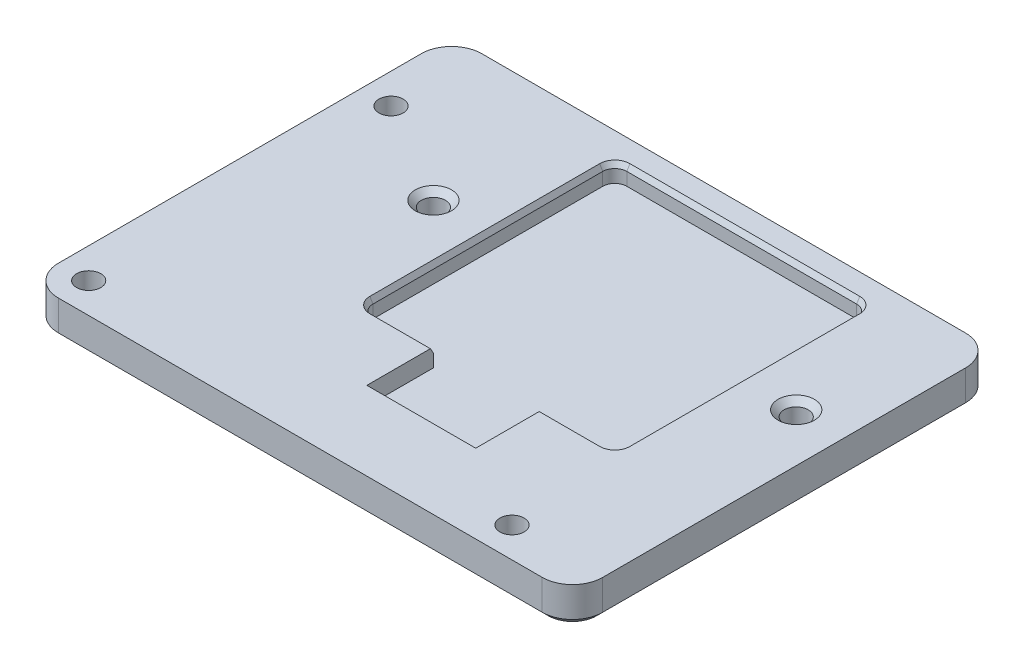
from build123d import *

# Parameters (mm, degrees)
SKETCH_1_W          = 90
SKETCH_1_H          = 70
SKETCH_1_R          = 2
EXTRUDE_1_DEPTH     = 6
FILLET_1_R          = 5
SKETCH_2_W          = 42
SKETCH_2_H          = 42
CUT_EXTRUDE_1_DEPTH = 3
SKETCH_3_W          = 18
SKETCH_3_H          = 18
CUT_EXTRUDE_2_DEPTH = 3
FILLET_2_R          = 2
CHAMFER_1_SIZE      = 2
SKETCH_4_R          = 2
CUT_EXTRUDE_3_DEPTH = 5
CHAMFER_2_SIZE      = 1
CHAMFER_3_SIZE      = 1
CHAMFER_4_SIZE      = 0.5
CHAMFER_4_SIZE2     = 0.866025404


with BuildPart() as part:
    # Эскиз1 → Бобышка-Вытянуть1 (new body)
    # profile 1 of 2: a face of its own
    with BuildSketch(Plane(origin=(0, 0, 0), x_dir=(1, 0, 0), z_dir=(0, 1, 0))):
        with Locations((5, 5)):
            Rectangle(SKETCH_1_W, SKETCH_1_H)
        with Locations(Location((35, -25, 0), (0, 0, 270))):
            Circle(SKETCH_1_R, mode=Mode.SUBTRACT)
        with Locations(Location((-35, -25, 0), (0, 0, 270))):
            Circle(SKETCH_1_R, mode=Mode.SUBTRACT)
        with Locations((35, 25)):
            Circle(SKETCH_1_R, mode=Mode.SUBTRACT)
        with Locations(Location((-35, 25, 0), (0, 0, 270))):
            Circle(SKETCH_1_R, mode=Mode.SUBTRACT)
    # profile 2 of 2: a face of its own
    with BuildSketch(Plane(origin=(0, 0, 0), x_dir=(1, 0, 0), z_dir=(0, 1, 0))):
        with Locations((35, 25)):
            Circle(SKETCH_1_R)
    extrude(amount=EXTRUDE_1_DEPTH)

    # Скругление1
    fillet_1_edges = [part.edges().sort_by_distance(p)[0] for p in [
        (-40, 3, 30),
        (-40, 3, -40),
        (50, 3, -40),
        (50, 3, 30),
    ]]
    fillet(fillet_1_edges, radius=FILLET_1_R)

    # Эскиз2 → Вырез-Вытянуть1 (cut)
    with BuildSketch(Plane(origin=(0, 6, 0), x_dir=(1, 0, 0), z_dir=(0, 1, 0))):
        with Locations((12, 15)):
            Rectangle(SKETCH_2_W, SKETCH_2_H)
    extrude(amount=-CUT_EXTRUDE_1_DEPTH, mode=Mode.SUBTRACT)

    # Эскиз3 → Вырез-Вытянуть2 (cut)
    with BuildSketch(Plane(origin=(0, 6, 0), x_dir=(1, 0, 0), z_dir=(0, 1, 0))):
        with Locations((12, -6)):
            Rectangle(SKETCH_3_W, SKETCH_3_H)
    extrude(amount=-CUT_EXTRUDE_2_DEPTH, mode=Mode.SUBTRACT)

    # Скругление2
    fillet_2_edges = [part.edges().sort_by_distance(p)[0] for p in [
        (33, 4.5, -36),
        (33, 4.5, 6),
        (-9, 4.5, 6),
        (-9, 4.5, -36),
    ]]
    fillet(fillet_2_edges, radius=FILLET_2_R)

    # Фаска1
    chamfer_1_edges = [part.edges().sort_by_distance(p)[0] for p in [
        (12, 6, 15),
    ]]
    chamfer(chamfer_1_edges, length=CHAMFER_1_SIZE)

    # Эскиз4 → Вырез-Вытянуть3 (cut)
    with BuildSketch(Plane(origin=(0, 6, 0), x_dir=(1, 0, 0), z_dir=(0, 1, 0))):
        with Locations(Location((-18, 15, 0), (0, 0, 270))):
            Circle(SKETCH_4_R)
        with Locations(Location((42, 15, 0), (0, 0, 90))):
            Circle(SKETCH_4_R)
    extrude(amount=-CUT_EXTRUDE_3_DEPTH, mode=Mode.SUBTRACT)

    # Фаска2
    chamfer_2_edges = [part.edges().sort_by_distance(p)[0] for p in [
        (-18, 6, -17),
        (42, 6, -13),
    ]]
    chamfer(chamfer_2_edges, length=CHAMFER_2_SIZE)

    # Фаска3
    chamfer_3_edges = [part.edges().sort_by_distance(p)[0] for p in [
        (-35, 0, -27),
        (-35, 0, 23),
        (35, 0, 23),
        (-40, 0, -5),
        (5, 0, 30),
        (5, 0, -40),
        (50, 0, -5),
        (-38.535533906, 0, 28.535533906),
        (48.535533906, 0, 28.535533906),
        (48.535533906, 0, -38.535533906),
        (-38.535533906, 0, -38.535533906),
    ]]
    chamfer(chamfer_3_edges, length=CHAMFER_3_SIZE)

    # Фаска4
    chamfer_4_edges = [part.edges().sort_by_distance(p)[0] for p in [
        (26, 6, 6),
        (33, 6, -15),
        (-2, 6, 6),
        (-9, 6, -15),
        (12, 6, -36),
        (32.414213562, 6, 5.414213562),
        (-8.414213562, 6, 5.414213562),
        (-8.414213562, 6, -35.414213562),
        (32.414213562, 6, -35.414213562),
    ]]
    chamfer_4_side = [part.faces().sort_by_distance(p)[0] for p in [
        (-18, 6, -19.140175425),
    ]]
    chamfer(chamfer_4_edges, length=CHAMFER_4_SIZE, length2=CHAMFER_4_SIZE2, reference=chamfer_4_side[0])


solid = part.part
